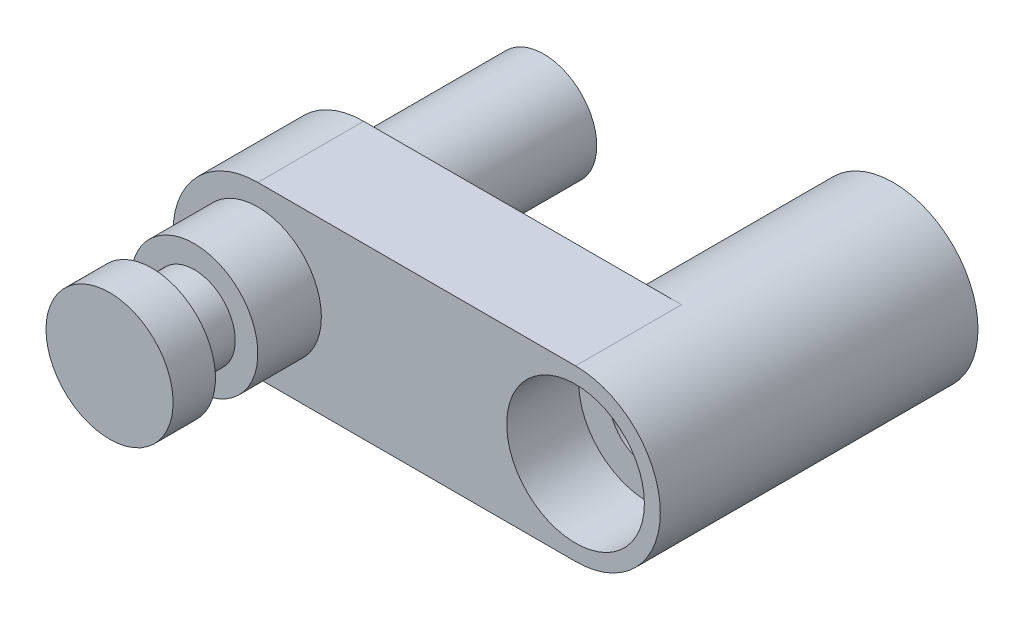
from build123d import *

# Parameters (mm, degrees)
SKETCH1_R                                           = 4
BOSS_EXTRUDE1_DEPTH                                 = 10
BOSS_EXTRUDE2_DEPTH                                 = 5
SKETCH2_3_R                                         = 2.5
BOSS_EXTRUDE3_DEPTH                                 = 8.5
CBORE_FOR_M3_HEX_SOCKET_HEAD_CAP_SCREW1_D           = 3.6
CBORE_FOR_M3_HEX_SOCKET_HEAD_CAP_SCREW1_CBORE_D     = 6.5
CBORE_FOR_M3_HEX_SOCKET_HEAD_CAP_SCREW1_CBORE_DEPTH = 3.4


with BuildPart() as part:
    # Sketch1 → Boss-Extrude1 (new body)
    with BuildSketch(Plane.XY):
        Circle(SKETCH1_R)
    extrude(amount=BOSS_EXTRUDE1_DEPTH)

    # Sketch2 → Boss-Extrude2 (add)
    with BuildSketch(Plane.XY.offset(10)):
        with BuildLine():
            Line((0, 4), (-15, 4))
            ThreePointArc((-15, 4), (-19, 0), (-15, -4))
            Line((-15, -4), (0, -4))
            ThreePointArc((0, -4), (4, 0), (0, 4))
        make_face()
    extrude(amount=BOSS_EXTRUDE2_DEPTH)

    # Sketch2<3> → Boss-Extrude3 (add)
    with BuildSketch(Plane.XY.offset(10)):
        with Locations((-15, 0)):
            Circle(SKETCH2_3_R)
    extrude(amount=-BOSS_EXTRUDE3_DEPTH)

    # CBORE for M3 Hex Socket Head Cap Screw1 (through all)
    with Locations(Plane.XY.offset(15)):
        with Locations((0, 0)):
            CounterBoreHole(CBORE_FOR_M3_HEX_SOCKET_HEAD_CAP_SCREW1_D / 2, CBORE_FOR_M3_HEX_SOCKET_HEAD_CAP_SCREW1_CBORE_D / 2, CBORE_FOR_M3_HEX_SOCKET_HEAD_CAP_SCREW1_CBORE_DEPTH)

    # Sketch6 → Revolve1 (revolve)
    with BuildSketch(Plane(origin=(0, 0, 0), x_dir=(1, 0, 0), z_dir=(0, 1, 0))):
        Polygon((-15, -15), (-18, -15), (-18, -18), (-16.934791303, -18), (-16.934791303, -20), (-18, -20), (-18, -22), (-15, -22), align=None)
    revolve(axis=Axis((-15, 0, 10), (0, 0, 1)))


solid = part.part
